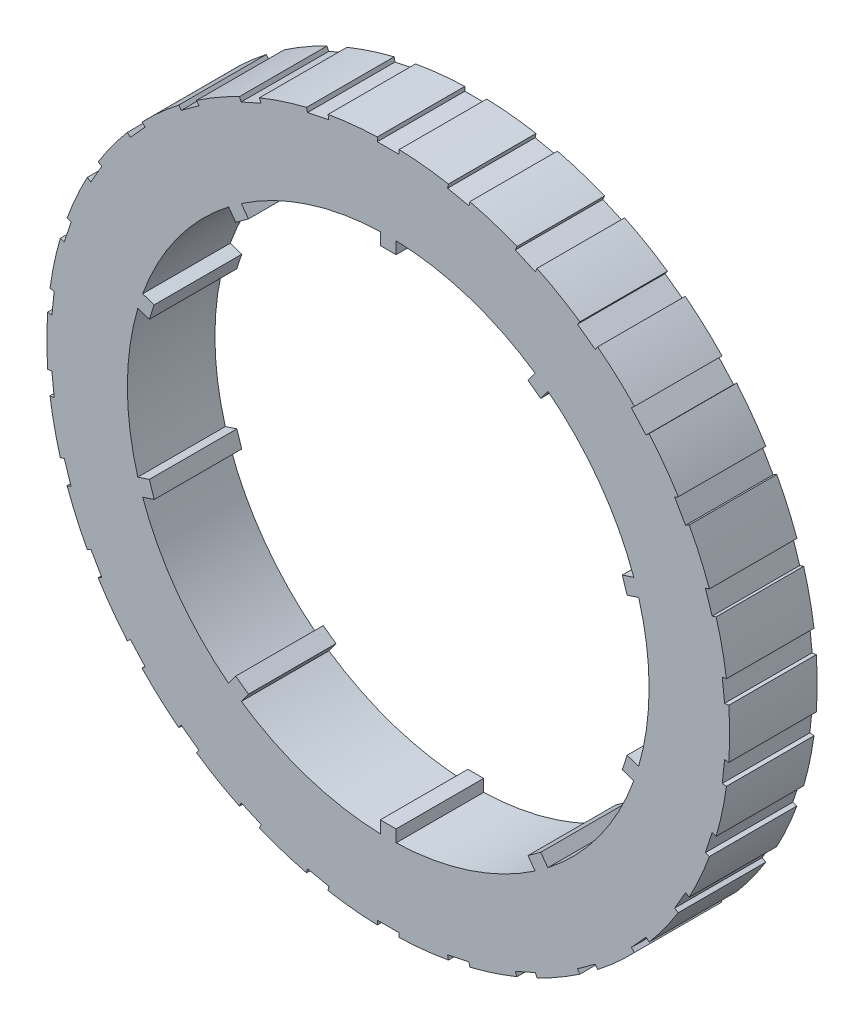
from build123d import *

# Parameters (mm, degrees)
SKETCH2_R           = 39
BOSS_EXTRUDE1_DEPTH = 10
SKETCH3_R           = 29.8
CUT_EXTRUDE1_DEPTH  = 57.053545829
SKETCH4_W           = 1.8
SKETCH4_H           = 2.8
BOSS_EXTRUDE2_DEPTH = 10
CIRPATTERN1_COUNT   = 10
SKETCH5_W           = 2.5
SKETCH5_H           = 1
CUT_EXTRUDE2_DEPTH  = 57.053545829
CIRPATTERN3_COUNT   = 30


with BuildPart() as part:
    # Sketch2 → Boss-Extrude1 (new body)
    with BuildSketch(Plane.XY):
        Circle(SKETCH2_R)
    extrude(amount=BOSS_EXTRUDE1_DEPTH)

    # Sketch3 → Cut-Extrude1 (cut, through all)
    with BuildSketch(Plane.XY):
        Circle(SKETCH3_R)
    extrude(amount=CUT_EXTRUDE1_DEPTH, mode=Mode.SUBTRACT)

    # Sketch4 → Boss-Extrude2 (add)
    with BuildSketch(Plane.XY):
        with Locations((0, 29.8)):
            Rectangle(SKETCH4_W, SKETCH4_H)
    boss_extrude2 = extrude(amount=BOSS_EXTRUDE2_DEPTH)

    # CirPattern1: Boss-Extrude2 ×10 about axis
    cirpattern1_axis = Axis((0, 0, 0), (0, 0, 1))
    for i in range(1, CIRPATTERN1_COUNT):
        add(boss_extrude2.rotate(cirpattern1_axis, i * 360 / CIRPATTERN1_COUNT))

    # Sketch5 → Cut-Extrude2 (cut, through all)
    with BuildSketch(Plane.XY):
        with Locations((0, 39)):
            Rectangle(SKETCH5_W, SKETCH5_H)
    cut_extrude2 = extrude(amount=CUT_EXTRUDE2_DEPTH, mode=Mode.SUBTRACT)

    # CirPattern3: Cut-Extrude2 ×30 about axis
    cirpattern3_axis = Axis((0, 0, 0), (0, 0, 1))
    for i in range(1, CIRPATTERN3_COUNT):
        add(cut_extrude2.rotate(cirpattern3_axis, i * 360 / CIRPATTERN3_COUNT), mode=Mode.SUBTRACT)


solid = part.part
